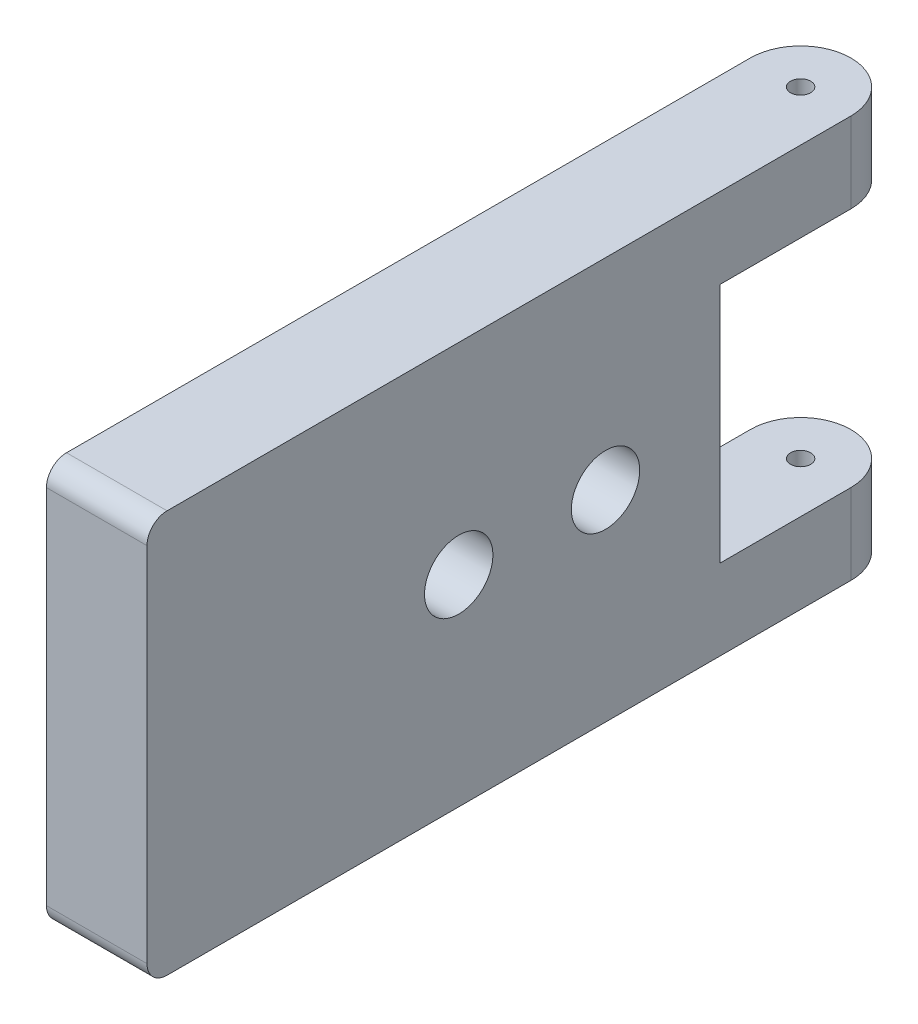
from build123d import *

# Parameters (mm, degrees)
SKETCHSIDE_R                          = 0.5
BOSSEXTRUDESIDE_DEPTH                 = 20
CUTEXTRUDEDISTALROOM_DEPTH            = 41.388736054
CUTEXTRUDEDISTALROOM_DEPTH_BACK       = 41.388736054
SKETCHDISTALROOM_W                    = 9
SKETCHDISTALROOM_H                    = 12
FILLETBUTTOM_R                        = 1
CSKM3FLATHEADMACHINESCREW_D           = 3.4
CSKM3FLATHEADMACHINESCREW_CSINK_D     = 6.3
CSKM3FLATHEADMACHINESCREW_CSINK_ANGLE = 90


with BuildPart() as part:
    # SketchSide → BossExtrudeSide (new body)
    with BuildSketch(Plane(origin=(0, 0, 0), x_dir=(1, 0, 0), z_dir=(0, 1, 0))):
        with BuildLine():
            Line((-2.5, -35), (2.5, -35))
            Line((2.5, -35), (2.5, 0))
            ThreePointArc((2.5, 0), (0, 2.5), (-2.5, 0))
            Line((-2.5, 0), (-2.5, -35))
        make_face()
        with Locations(Location((0, 0, 0), (0, 0, 270))):
            Circle(SKETCHSIDE_R, mode=Mode.SUBTRACT)
    extrude(amount=BOSSEXTRUDESIDE_DEPTH)

    # SketchDistalRoom → CutExtrudeDistalRoom (cut, two sides: drawn at the far end of the back side and taken through both)
    with BuildSketch(Plane(origin=(0, 0, 0), x_dir=(0, 0, -1), z_dir=(1, 0, 0)).offset(-CUTEXTRUDEDISTALROOM_DEPTH_BACK)):
        with Locations((-2, 10)):
            Rectangle(SKETCHDISTALROOM_W, SKETCHDISTALROOM_H)
    extrude(amount=CUTEXTRUDEDISTALROOM_DEPTH + CUTEXTRUDEDISTALROOM_DEPTH_BACK, mode=Mode.SUBTRACT)

    # FilletButtom
    filletbuttom_edges = [part.edges().sort_by_distance(p)[0] for p in [
        (0, 0, 35),
        (0, 20, 35),
    ]]
    fillet(filletbuttom_edges, radius=FILLETBUTTOM_R)

    # CSKM3FlatHeadMachineScrew (through all)
    with Locations(Plane(origin=(-2.5, 10, 12.2), x_dir=(0, 0, -1), z_dir=(-1, 0, 0))):
        with Locations((0, 0), (-7.3, 0)):
            CounterSinkHole(CSKM3FLATHEADMACHINESCREW_D / 2, CSKM3FLATHEADMACHINESCREW_CSINK_D / 2, counter_sink_angle=CSKM3FLATHEADMACHINESCREW_CSINK_ANGLE)


solid = part.part
